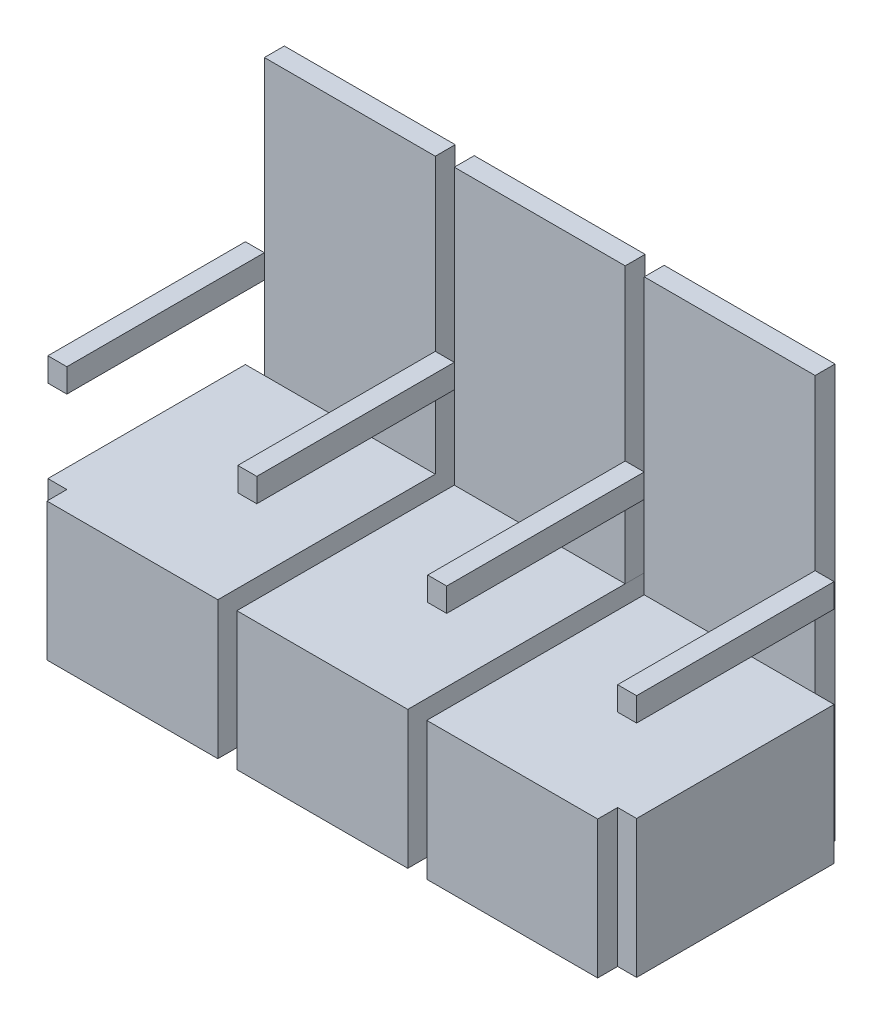
from build123d import *

# Parameters (mm, degrees)
BOSS_EXTRUDE1_DEPTH   = 368.3
BOSS_EXTRUDE1_2_DEPTH = 368.3
SKETCH1_W             = 457.2
SKETCH1_H             = 635
BOSS_EXTRUDE1_3_DEPTH = 368.3
SKETCH2_W             = 457.2
SKETCH2_H             = 53.34
BOSS_EXTRUDE2_DEPTH   = 736.6
SKETCH3_W             = 50.8
SKETCH3_H             = 63.5
BOSS_EXTRUDE3_DEPTH   = 528.32
BOSS_EXTRUDE3_2_DEPTH = 528.32
BOSS_EXTRUDE3_3_DEPTH = 528.32
BOSS_EXTRUDE3_4_DEPTH = 528.32


with BuildPart() as part:
    # Sketch1 → Boss-Extrude1 (new body)
    with BuildSketch(Plane(origin=(0, 0, 0), x_dir=(1, 0, 0), z_dir=(0, 1, 0))):
        Polygon((-787.4, 264.16), (-736.6, 264.16), (-736.6, 317.5), (-279.4, 317.5), (-279.4, -317.5), (-736.6, -317.5), (-736.6, -264.16), (-787.4, -264.16), align=None)
    extrude(amount=BOSS_EXTRUDE1_DEPTH)



with BuildPart() as body_2:
    # Sketch1 → Boss-Extrude1 2 (new body)
    with BuildSketch(Plane(origin=(0, 0, 0), x_dir=(1, 0, 0), z_dir=(0, 1, 0))):
        Polygon((279.4, -317.5), (736.6, -317.5), (736.6, -264.16), (787.4, -264.16), (787.4, 264.16), (736.6, 264.16), (736.6, 317.5), (279.4, 317.5), align=None)
    extrude(amount=BOSS_EXTRUDE1_2_DEPTH)


with BuildPart() as body_3:
    # Sketch1 → Boss-Extrude1 3 (new body)
    with BuildSketch(Plane(origin=(0, 0, 0), x_dir=(1, 0, 0), z_dir=(0, 1, 0))):
        Rectangle(SKETCH1_W, SKETCH1_H)
    extrude(amount=BOSS_EXTRUDE1_3_DEPTH)


with BuildPart() as part_1:
    add(part.part)

    add(body_2.part)  # Boss-Extrude2 merges body 2
    # Sketch2 → Boss-Extrude2 (add)
    with BuildSketch(Plane(origin=(0, 368.3, 0), x_dir=(1, 0, 0), z_dir=(0, 1, 0))):
        with Locations((-508, 290.83)):
            Rectangle(SKETCH2_W, SKETCH2_H)
        with Locations((508, 290.83)):
            Rectangle(SKETCH2_W, SKETCH2_H)
        with Locations((0, 290.83)):
            Rectangle(SKETCH2_W, SKETCH2_H)
    extrude(amount=BOSS_EXTRUDE2_DEPTH)


with BuildPart() as body_3_2:
    # Sketch3 → Boss-Extrude3 (new body)
    with BuildSketch(Plane.XY.offset(-264.16)):
        with Locations((-762, 621.03)):
            Rectangle(SKETCH3_W, SKETCH3_H)
    extrude(amount=BOSS_EXTRUDE3_DEPTH)


with BuildPart() as body_4:
    # Sketch3 → Boss-Extrude3 2 (new body)
    with BuildSketch(Plane.XY.offset(-264.16)):
        with Locations((762, 621.03)):
            Rectangle(SKETCH3_W, SKETCH3_H)
    extrude(amount=BOSS_EXTRUDE3_2_DEPTH)


with BuildPart() as body_5:
    # Sketch3 → Boss-Extrude3 3 (new body)
    with BuildSketch(Plane.XY.offset(-264.16)):
        with Locations((-254, 621.03)):
            Rectangle(SKETCH3_W, SKETCH3_H)
    extrude(amount=BOSS_EXTRUDE3_3_DEPTH)


with BuildPart() as body_6:
    # Sketch3 → Boss-Extrude3 4 (new body)
    with BuildSketch(Plane.XY.offset(-264.16)):
        with Locations((254, 621.03)):
            Rectangle(SKETCH3_W, SKETCH3_H)
    extrude(amount=BOSS_EXTRUDE3_4_DEPTH)


solid = Compound([body_3.part, part_1.part, body_3_2.part, body_4.part, body_5.part, body_6.part])
